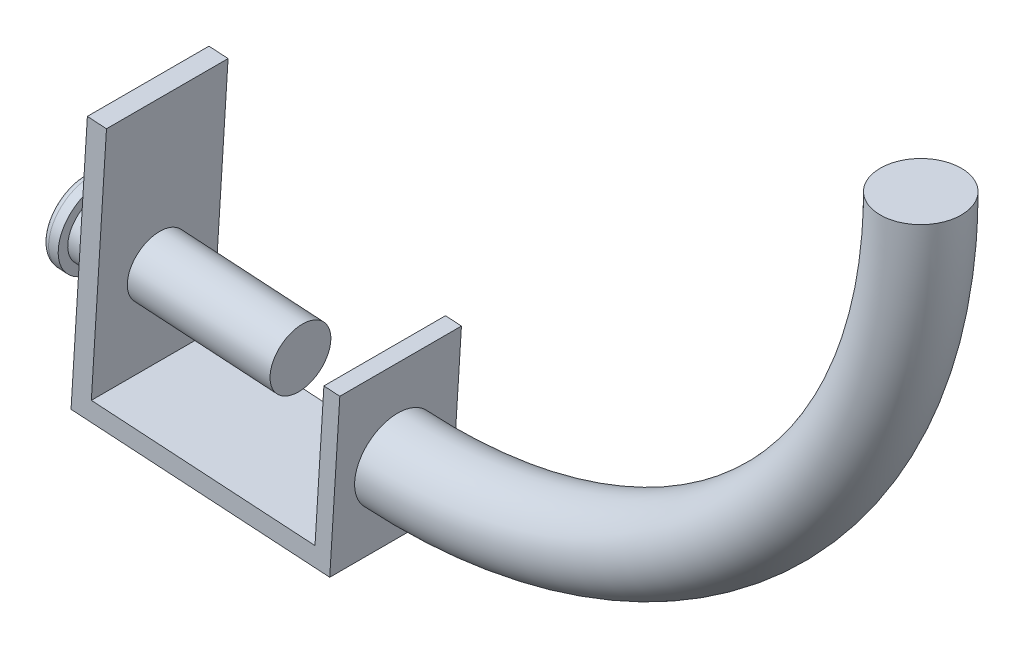
from build123d import *

# Parameters (mm, degrees)
SWEEP5_PROFILE_R         = 12.7
SKETCH70_W               = 38.1
SKETCH70_H               = 50.8
BOSS_EXTRUDE1_DEPTH      = 5
SKETCH71_W               = 38.1
SKETCH71_H               = 6
BOSS_EXTRUDE2_DEPTH      = 76.2
SKETCH72_W               = 6
SKETCH72_H               = 38.1
BOSS_EXTRUDE3_DEPTH      = 76.2
BOSS_EXTRUDE4_DEPTH      = 12.7
BOSS_EXTRUDE4_DEPTH_BACK = 50.8
SKETCH73_R               = 9.509112568
SKETCH74_R               = 12.5
BOSS_EXTRUDE5_DEPTH      = 5
FILLET1_R                = 2


with BuildPart() as part:
    # Sweep5: sweep along a path in Sketch47
    with BuildLine(Plane.XY) as sweep5_path:
        ThreePointArc((-9.644129197, -154.699679289), (106.137081113, -112.95981592), (155, 0))
    # Sweep5 profile (on start of the path) → Sweep5 (sweep)
    with BuildSketch(Plane(origin=(-9.644129197, -154.699679289, 0), x_dir=(0.06222018836928112, 0.9980624470238779, 0), z_dir=(0.9980624470238779, -0.06222018836928112, 0))):
        Circle(SWEEP5_PROFILE_R)
    sweep(path=sweep5_path.line)

    # Sketch70 → Boss-Extrude1 (add)
    with BuildSketch(Plane(origin=(0, 0, 0), x_dir=(0, 0, 1), z_dir=(-0.9980624470238779, 0.0622201883692814, 0))):
        with Locations((0, -153.127799021)):
            Rectangle(SKETCH70_W, SKETCH70_H)
    extrude(amount=BOSS_EXTRUDE1_DEPTH)

    # Sketch71 → Boss-Extrude2 (add)
    with BuildSketch(Plane(origin=(-4.990312235, 0.311100942, 0), x_dir=(0, 0, 1), z_dir=(-0.9980624470238779, 0.0622201883692814, 0))):
        with Locations((0, -175.527799021)):
            Rectangle(SKETCH71_W, SKETCH71_H)
    extrude(amount=BOSS_EXTRUDE2_DEPTH)

    # Sketch72 → Boss-Extrude3 (add)
    with BuildSketch(Plane(origin=(-10.734712154, -172.19351727, 0), x_dir=(0.9980624470238779, -0.0622201883692814, 0), z_dir=(0.0622201883692814, 0.9980624470238779, 0))):
        with Locations((-78.2, 0)):
            Rectangle(SKETCH72_W, SKETCH72_H)
    extrude(amount=BOSS_EXTRUDE3_DEPTH)

    # Sketch73 → Boss-Extrude4 (add, two sides: drawn at the far end of the back side and taken through both)
    with BuildSketch(Plane(origin=(-81.042670698, 5.052279296, 0), x_dir=(0, 0, 1), z_dir=(-0.9980624470238779, 0.06222018836928128, 0)).offset(-BOSS_EXTRUDE4_DEPTH_BACK)):
        with Locations(Location((0, -144.487448774, 0), (0, 0, 270))):
            Circle(SKETCH73_R)
    extrude(amount=BOSS_EXTRUDE4_DEPTH + BOSS_EXTRUDE4_DEPTH_BACK)

    # Sketch74 → Boss-Extrude5 (add)
    with BuildSketch(Plane(origin=(-93.718063776, 5.842475688, 0), x_dir=(0, 0, 1), z_dir=(-0.9980624470238779, 0.06222018836928128, 0))):
        with Locations(Location((0, -144.487448774, 0), (0, 0, 270))):
            Circle(SKETCH74_R)
    extrude(amount=BOSS_EXTRUDE5_DEPTH)

    # Fillet1
    fillet1_edges = [part.edges().sort_by_distance(p)[0] for p in [
        (-106.920659936, -125.578139471, 0),
    ]]
    fillet(fillet1_edges, radius=FILLET1_R)


solid = part.part
